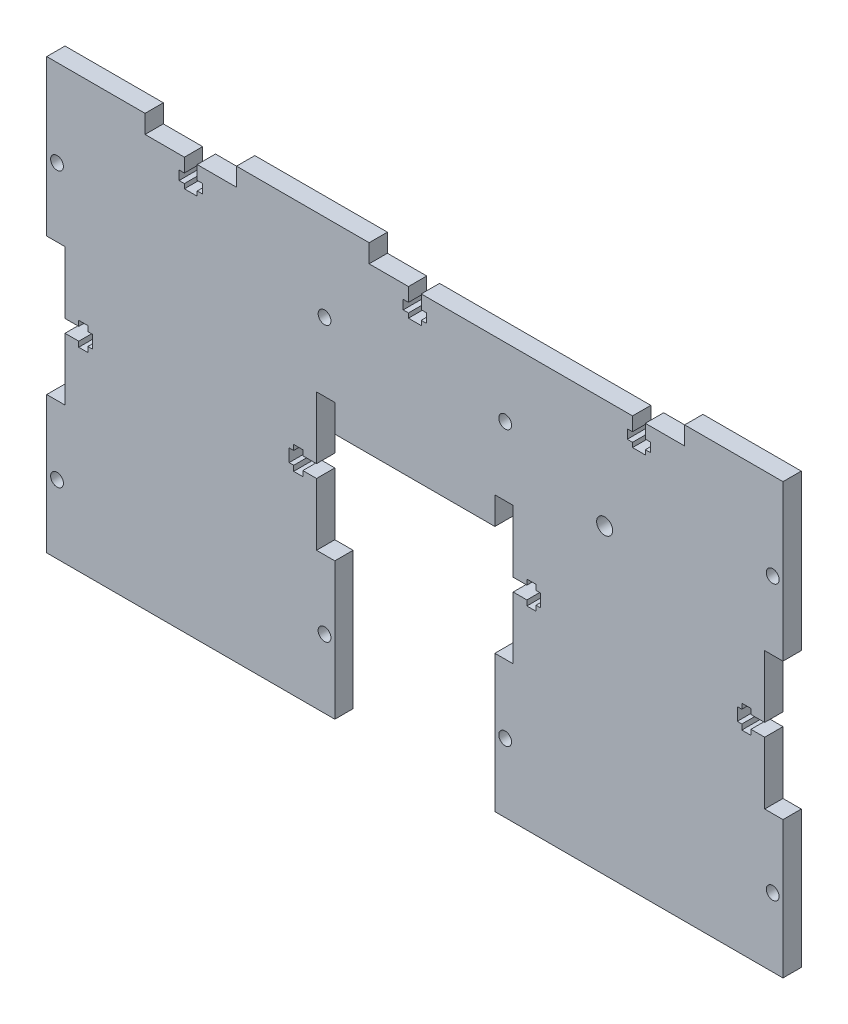
from build123d import *

# Parameters (mm, degrees)
SKETCH_1_R      = 1.4
SKETCH_1_R_2    = 1.75
EXTRUDE_1_DEPTH = 4


with BuildPart() as part:
    # Эскиз1 → Бобышка-Вытянуть1 (new body)
    with BuildSketch(Plane.XY):
        Polygon((-17.5, -14), (-17.5, -20), (17.5, -20), (17.5, -14), (21.5, -14), (21.5, -27.6), (24.5, -27.6), (24.5, -26.45), (26.5, -26.45), (26.5, -27.6), (27.5, -27.6), (27.5, -30.4), (26.5, -30.4), (26.5, -31.55), (24.5, -31.55), (24.5, -30.4), (21.5, -30.4), (21.5, -44), (17.5, -44), (17.5, -74), (80.5, -74), (80.5, -44), (76.5, -44), (76.5, -30.4), (73.5, -30.4), (73.5, -31.55), (71.5, -31.55), (71.5, -30.4), (70.5, -30.4), (70.5, -27.6), (71.5, -27.6), (71.5, -26.45), (73.5, -26.45), (73.5, -27.6), (76.5, -27.6), (76.5, -14), (80.5, -14), (80.5, 20), (59, 20), (59, 16), (50.4, 16), (50.4, 13), (51.55, 13), (51.55, 11), (50.4, 11), (50.4, 10), (47.6, 10), (47.6, 11), (46.45, 11), (46.45, 13), (47.6, 13), (47.6, 16), (1.4, 16), (1.4, 13), (2.55, 13), (2.55, 11), (1.4, 11), (1.4, 10), (-1.4, 10), (-1.4, 11), (-2.55, 11), (-2.55, 13), (-1.4, 13), (-1.4, 16), (-10, 16), (-10, 20), (-39, 20), (-39, 16), (-47.6, 16), (-47.6, 13), (-46.45, 13), (-46.45, 11), (-47.6, 11), (-47.6, 10), (-50.4, 10), (-50.4, 11), (-51.55, 11), (-51.55, 13), (-50.4, 13), (-50.4, 16), (-59, 16), (-59, 20), (-80.5, 20), (-80.5, -14), (-76.5, -14), (-76.5, -27.6), (-73.5, -27.6), (-73.5, -26.45), (-71.5, -26.45), (-71.5, -27.6), (-70.5, -27.6), (-70.5, -30.4), (-71.5, -30.4), (-71.5, -31.55), (-73.5, -31.55), (-73.5, -30.4), (-76.5, -30.4), (-76.5, -44), (-80.5, -44), (-80.5, -74), (-17.5, -74), (-17.5, -44), (-21.5, -44), (-21.5, -30.4), (-24.5, -30.4), (-24.5, -31.55), (-26.5, -31.55), (-26.5, -30.4), (-27.5, -30.4), (-27.5, -27.6), (-26.5, -27.6), (-26.5, -26.45), (-24.5, -26.45), (-24.5, -27.6), (-21.5, -27.6), (-21.5, -14), align=None)
        with Locations((-19.75, 1)):
            Circle(SKETCH_1_R, mode=Mode.SUBTRACT)
        with Locations((-78.25, -59)):
            Circle(SKETCH_1_R, mode=Mode.SUBTRACT)
        with Locations((-19.75, -59)):
            Circle(SKETCH_1_R, mode=Mode.SUBTRACT)
        with Locations((-78.25, 1)):
            Circle(SKETCH_1_R, mode=Mode.SUBTRACT)
        with Locations((78.25, 1)):
            Circle(SKETCH_1_R, mode=Mode.SUBTRACT)
        with Locations((19.75, -59)):
            Circle(SKETCH_1_R, mode=Mode.SUBTRACT)
        with Locations((78.25, -59)):
            Circle(SKETCH_1_R, mode=Mode.SUBTRACT)
        with Locations((41.5, -7.9)):
            Circle(SKETCH_1_R_2, mode=Mode.SUBTRACT)
        with Locations((19.75, 1)):
            Circle(SKETCH_1_R, mode=Mode.SUBTRACT)
    extrude(amount=EXTRUDE_1_DEPTH)


solid = part.part
